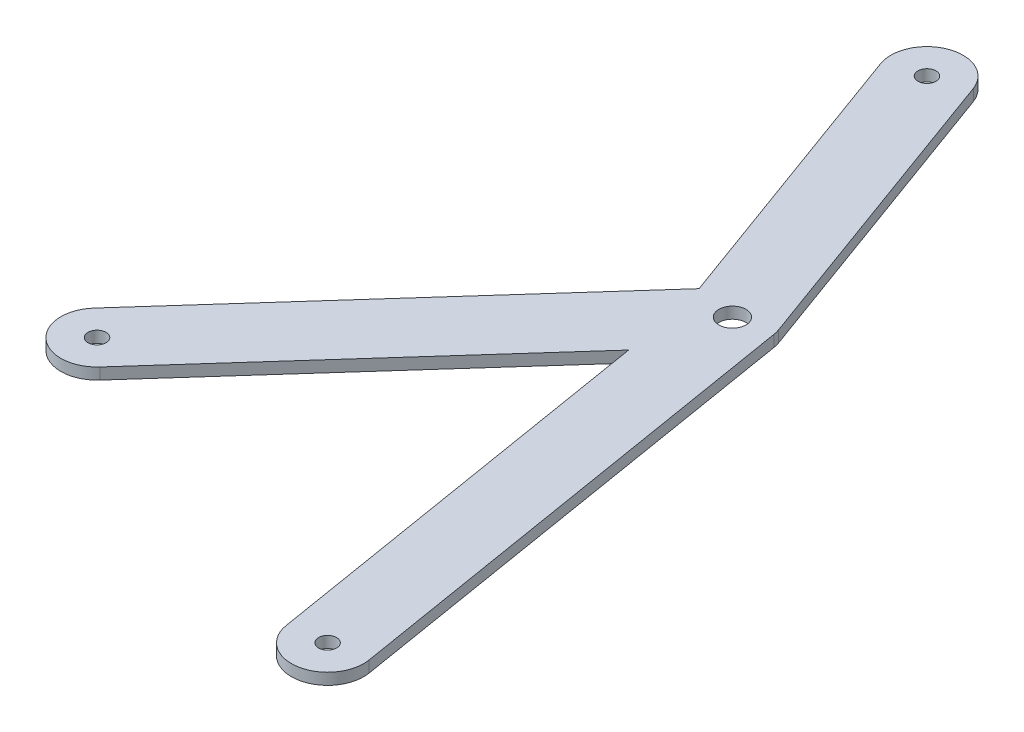
from build123d import *

# Parameters (mm, degrees)
BOSS_EXTRUDE1_DEPTH = 4
SKETCH5_R           = 4.7625
CUT_EXTRUDE1_DEPTH  = 272.785715814
SKETCH8_R           = 3.175
CUT_EXTRUDE3_DEPTH  = 272.785715814


with BuildPart() as part:
    # Sketch1 → Boss-Extrude1 (new body)
    with BuildSketch(Plane(origin=(0, 0, 0), x_dir=(1, 0, 0), z_dir=(0, 1, 0))):
        with BuildLine():
            Line((-55.078065391, 65.670374736), (-15.882456002, -41.901827969))
            ThreePointArc((-15.882456002, -41.901827969), (-15.529329867, -43.032283758), (-15.283044075, -44.190718765))
            Line((-15.283044075, -44.190718765), (12.6911511, -214.459876374))
            ThreePointArc((12.6911511, -214.459876374), (2.218090383, -229.050798182), (-12.372831425, -218.577737465))
            Line((-12.372831425, -218.577737465), (-36.044890736, -74.494178583))
            Line((-36.044890736, -74.494178583), (-123.815593368, -172.591431542))
            ThreePointArc((-123.815593368, -172.591431542), (-141.748449811, -173.587754678), (-142.744772948, -155.654898235))
            Line((-142.744772948, -155.654898235), (-42.351793784, -43.450310863))
            Line((-42.351793784, -43.450310863), (-78.943224061, 56.974732054))
            ThreePointArc((-78.943224061, 56.974732054), (-71.358466067, 73.25513273), (-55.078065391, 65.670374736))
        make_face()
    extrude(amount=BOSS_EXTRUDE1_DEPTH)

    # Sketch5 → Cut-Extrude1 (cut, through all)
    with BuildSketch(Plane(origin=(0, 4, 0), x_dir=(1, 0, 0), z_dir=(0, 1, 0))):
        with Locations(Location((-27.815035337, -46.24964931, 0), (0, 0, 270))):
            Circle(SKETCH5_R)
    extrude(amount=-CUT_EXTRUDE1_DEPTH, mode=Mode.SUBTRACT)

    # Sketch8 → Cut-Extrude3 (cut, through all)
    with BuildSketch(Plane(origin=(0, 4, 0), x_dir=(1, 0, 0), z_dir=(0, 1, 0))):
        with Locations(Location((-67.010644726, 61.322553395, 0), (0, 0, 270))):
            Circle(SKETCH8_R)
        with Locations(Location((0.159159837, -216.518806919, 0), (0, 0, 270))):
            Circle(SKETCH8_R)
        with Locations(Location((-133.280183158, -164.123164888, 0), (0, 0, 270))):
            Circle(SKETCH8_R)
    extrude(amount=-CUT_EXTRUDE3_DEPTH, mode=Mode.SUBTRACT)


solid = part.part
